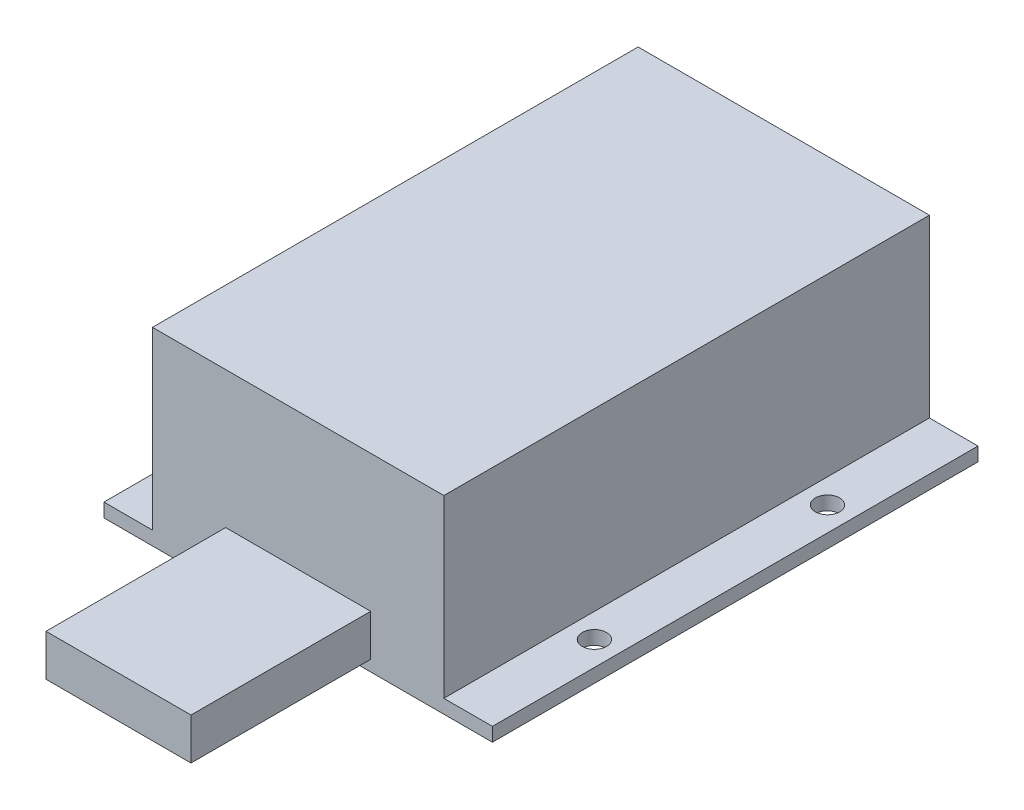
from build123d import *

# Parameters (mm, degrees)
EXTRUDE_1_DEPTH     = 50
SKETCH_3_R          = 2.5
CUT_EXTRUDE_1_DEPTH = 74.539294107
SKETCH_4_W          = 29.863739494
SKETCH_4_H          = 8.563866473
EXTRUDE_2_DEPTH     = 37


with BuildPart() as part:
    # 草图2 → 凸台-拉伸1 (new, symmetric)
    with BuildSketch(Plane.XY):
        Polygon((-30, 19.5), (30, 19.5), (30, -16.666666667), (40, -16.666666667), (40, -19.5), (-40, -19.5), (-40, -16.666666667), (-30, -16.666666667), align=None)
    extrude(amount=EXTRUDE_1_DEPTH, both=True)

    # 草图3 → 切除-拉伸1 (cut, through all)
    with BuildSketch(Plane(origin=(0, -16.666666667, 0), x_dir=(1, 0, 0), z_dir=(0, 1, 0))):
        with Locations(Location((-35, 24, 0), (0, 0, 270))):
            Circle(SKETCH_3_R)
        with Locations(Location((35, 24, 0), (0, 0, 270))):
            Circle(SKETCH_3_R)
        with Locations(Location((-35, -24, 0), (0, 0, 270))):
            Circle(SKETCH_3_R)
        with Locations(Location((35, -24, 0), (0, 0, 270))):
            Circle(SKETCH_3_R)
    extrude(amount=-CUT_EXTRUDE_1_DEPTH, mode=Mode.SUBTRACT)

    # 草图4 → 凸台-拉伸2 (add)
    with BuildSketch(Plane.XY.offset(50)):
        with Locations((0, -12.959263215)):
            Rectangle(SKETCH_4_W, SKETCH_4_H)
    extrude(amount=EXTRUDE_2_DEPTH)


solid = part.part
